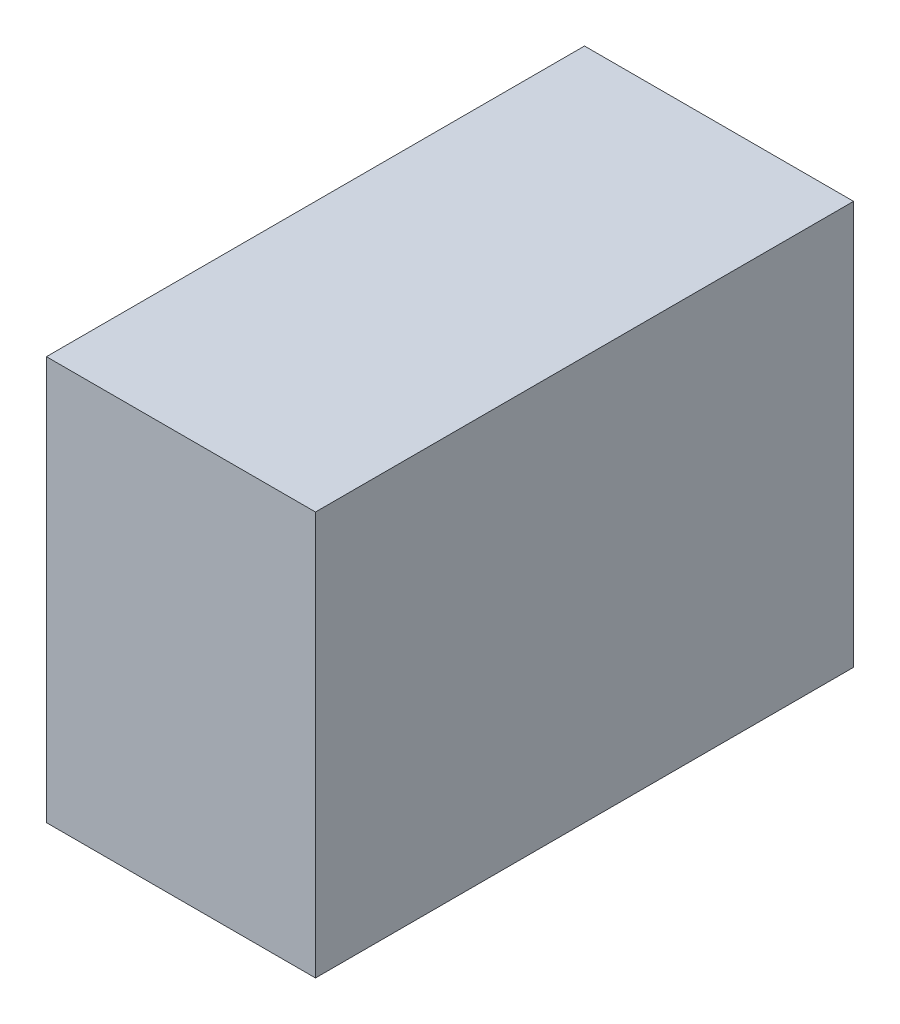
from build123d import *

# Parameters (mm, degrees)
SKETCH_MAIN_PROFILE_W = 20
SKETCH_MAIN_PROFILE_H = 30
FEATURE_BLOCK_DEPTH   = 40


with BuildPart() as part:
    # sketch:main-profile → feature:block (new body)
    with BuildSketch(Plane.XY):
        with Locations((10, 15)):
            Rectangle(SKETCH_MAIN_PROFILE_W, SKETCH_MAIN_PROFILE_H)
    extrude(amount=FEATURE_BLOCK_DEPTH)


solid = part.part
